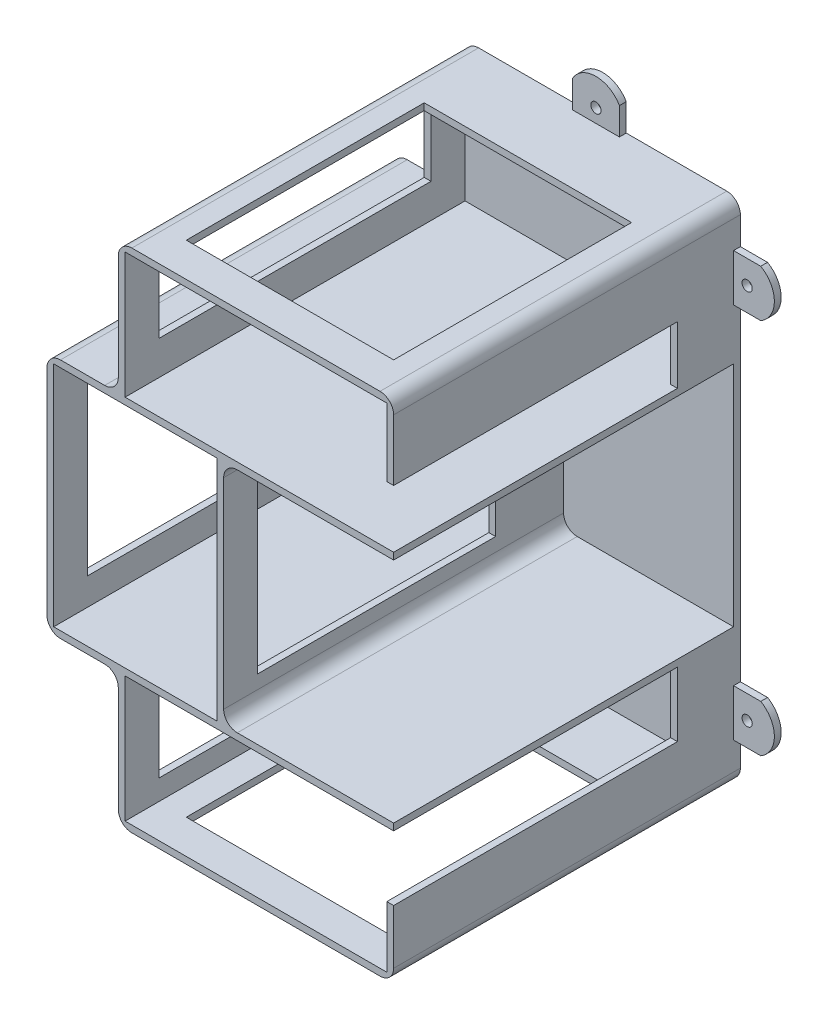
from build123d import *

# Parameters (mm, degrees)
BOSS_EXTRU_9_DEPTH       = 100
ESQUISSE31_W             = 77
ESQUISSE31_H             = 37
ESQUISSE31_W_2           = 48
ESQUISSE31_H_2           = 67
ENL_V_MAT_EXTRU_17_DEPTH = 100
ESQUISSE35_W             = 61
ESQUISSE35_H             = 70
ENL_V_MAT_EXTRU_20_DEPTH = 2
ESQUISSE37_W             = 70
ESQUISSE37_H             = 51
ENL_V_MAT_EXTRU_22_DEPTH = 52
ESQUISSE38_W             = 61
ESQUISSE38_H             = 70
ENL_V_MAT_EXTRU_23_DEPTH = 2
ESQUISSE36_W             = 80
ESQUISSE36_H             = 21
ENL_V_MAT_EXTRU_25_DEPTH = 2
ESQUISSE39_W             = 83.5
ESQUISSE39_H             = 17
ESQUISSE39_H_2           = 19
ENL_V_MAT_EXTRU_26_DEPTH = 2
ESQUISSE46_R             = 1.5
BOSS_EXTRU_10_DEPTH      = 2
CONG_59_R                = 4


with BuildPart() as part:
    # Esquisse27 → Boss.-Extru.9 (new body)
    with BuildSketch(Plane.XY):
        Polygon((148.5, -72.5), (67.5, -72.5), (67.5, -33.5), (46.5, -33.5), (46.5, 37.5), (67.5, 37.5), (67.5, 76.5), (148.5, 76.5), (148.5, 35.5), (98.5, 35.5), (98.5, -31.5), (148.5, -31.5), align=None)
    extrude(amount=BOSS_EXTRU_9_DEPTH)

    # Esquisse31 → Enlèv. mat.-Extru.17 (cut)
    with BuildSketch(Plane.XY.offset(100)):
        with Locations((108, 56)):
            Rectangle(ESQUISSE31_W, ESQUISSE31_H)
        with Locations((72.5, 2)):
            Rectangle(ESQUISSE31_W_2, ESQUISSE31_H_2)
        with Locations((108, -52)):
            Rectangle(ESQUISSE31_W, ESQUISSE31_H)
    extrude(amount=-ENL_V_MAT_EXTRU_17_DEPTH, mode=Mode.SUBTRACT)

    # Esquisse35 → Enlèv. mat.-Extru.20 (cut)
    with BuildSketch(Plane.XZ.offset(72.5)):
        with Locations((108, 55)):
            Rectangle(ESQUISSE35_W, ESQUISSE35_H)
    extrude(amount=-ENL_V_MAT_EXTRU_20_DEPTH, mode=Mode.SUBTRACT)

    # Esquisse37 → Enlèv. mat.-Extru.22 (cut)
    with BuildSketch(Plane.ZY.offset(-46.5)):
        with Locations((55, 2)):
            Rectangle(ESQUISSE37_W, ESQUISSE37_H)
    extrude(amount=-ENL_V_MAT_EXTRU_22_DEPTH, mode=Mode.SUBTRACT)

    # Esquisse38 → Enlèv. mat.-Extru.23 (cut)
    with BuildSketch(Plane(origin=(0, 76.5, 0), x_dir=(1, 0, 0), z_dir=(0, 1, 0))):
        with Locations((108, -55)):
            Rectangle(ESQUISSE38_W, ESQUISSE38_H)
    extrude(amount=-ENL_V_MAT_EXTRU_23_DEPTH, mode=Mode.SUBTRACT)

    # Esquisse36 → Enlèv. mat.-Extru.25 (cut)
    with BuildSketch(Plane.ZY.offset(-67.5)):
        with Locations((50, 58)):
            Rectangle(ESQUISSE36_W, ESQUISSE36_H)
        with Locations((50, -54)):
            Rectangle(ESQUISSE36_W, ESQUISSE36_H)
    extrude(amount=-ENL_V_MAT_EXTRU_25_DEPTH, mode=Mode.SUBTRACT)

    # Esquisse39 → Enlèv. mat.-Extru.26 (cut)
    with BuildSketch(Plane(origin=(148.5, 0, 0), x_dir=(0, 0, -1), z_dir=(1, 0, 0))):
        with Locations((-58.25, 46)):
            Rectangle(ESQUISSE39_W, ESQUISSE39_H)
        with Locations((-58.25, -43)):
            Rectangle(ESQUISSE39_W, ESQUISSE39_H_2)
    extrude(amount=-ENL_V_MAT_EXTRU_26_DEPTH, mode=Mode.SUBTRACT)

    # Esquisse46 → Boss.-Extru.10 (add)
    with BuildSketch(Plane(origin=(0, 0, 0), x_dir=(-1, 0, 0), z_dir=(0, 0, -1))):
        with BuildLine():
            Line((-148.5, 64.356406461), (-148.5, 76.5))
            Line((-148.5, 76.5), (-114.92820323, 76.5))
            Line((-114.92820323, 76.5), (-114.92820323, 84.5))
            ThreePointArc((-114.92820323, 84.5), (-108, 88.5), (-101.07179677, 84.5))
            Line((-101.07179677, 84.5), (-101.07179677, 76.5))
            Line((-101.07179677, 76.5), (-67.5, 76.5))
            Line((-67.5, 76.5), (-67.5, 68.5))
            Line((-67.5, 68.5), (-61.5, 68.5))
            Line((-61.5, 68.5), (-61.5, 59.8))
            ThreePointArc((-61.5, 59.8), (-57.55122926, 53.5), (-61.5, 47.2))
            Line((-61.5, 47.2), (-67.5, 47.2))
            Line((-67.5, 47.2), (-67.5, 37.5))
            Line((-67.5, 37.5), (-46.5, 37.5))
            Line((-46.5, 37.5), (-46.5, -33.5))
            Line((-46.5, -33.5), (-67.5, -33.5))
            Line((-67.5, -33.5), (-67.5, -43.199792715))
            Line((-67.5, -43.199792715), (-61.5, -43.199792715))
            ThreePointArc((-61.5, -43.199792715), (-57.551027919, -49.556334189), (-61.60179677, -55.848493732))
            Line((-61.60179677, -55.848493732), (-61.60179677, -64.5))
            Line((-61.60179677, -64.5), (-67.5, -64.5))
            Line((-67.5, -64.5), (-67.5, -72.5))
            Line((-67.5, -72.5), (-100.97, -72.5))
            Line((-100.97, -72.5), (-100.97, -80.5))
            ThreePointArc((-100.97, -80.5), (-107.89820323, -84.5), (-114.826406461, -80.5))
            Line((-114.826406461, -80.5), (-114.826406461, -72.5))
            Line((-114.826406461, -72.5), (-148.5, -72.5))
            Line((-148.5, -72.5), (-148.5, -60.356406461))
            Line((-148.5, -60.356406461), (-156.5, -60.356406461))
            ThreePointArc((-156.5, -60.356406461), (-160.5, -53.42820323), (-156.5, -46.5))
            Line((-156.5, -46.5), (-148.5, -46.5))
            Line((-148.5, -46.5), (-148.5, 50.5))
            Line((-148.5, 50.5), (-156.5, 50.5))
            ThreePointArc((-156.5, 50.5), (-160.5, 57.42820323), (-156.5, 64.356406461))
            Line((-156.5, 64.356406461), (-148.5, 64.356406461))
        make_face()
        with Locations((-108, 80.5)):
            Circle(ESQUISSE46_R, mode=Mode.SUBTRACT)
        with Locations((-152.5, 57.42820323)):
            Circle(ESQUISSE46_R, mode=Mode.SUBTRACT)
        with Locations((-64.55122926, 53.5)):
            Circle(ESQUISSE46_R, mode=Mode.SUBTRACT)
        with Locations(Location((-64.550801234, -49.5, 0), (0, 0, 180))):
            Circle(ESQUISSE46_R, mode=Mode.SUBTRACT)
        with Locations(Location((-152.5, -53.42820323, 0), (0, 0, 180))):
            Circle(ESQUISSE46_R, mode=Mode.SUBTRACT)
        with Locations(Location((-107.89820323, -76.5, 0), (0, 0, 180))):
            Circle(ESQUISSE46_R, mode=Mode.SUBTRACT)
    extrude(amount=BOSS_EXTRU_10_DEPTH)

    # Congé59
    cong_59_edges = [part.edges().sort_by_distance(p)[0] for p in [
        (98.5, 35.5, 50),
        (98.5, -31.5, 50),
        (148.5, -72.5, 49),
        (67.5, -72.5, 49),
        (67.5, -33.5, 49),
        (46.5, -33.5, 49),
        (46.5, 37.5, 49),
        (67.5, 37.5, 49),
        (67.5, 76.5, 49),
        (148.5, 76.5, 49),
        (61.5, 68.5, -1),
        (61.60179677, -64.5, -1),
    ]]
    fillet(cong_59_edges, radius=CONG_59_R)


solid = part.part
